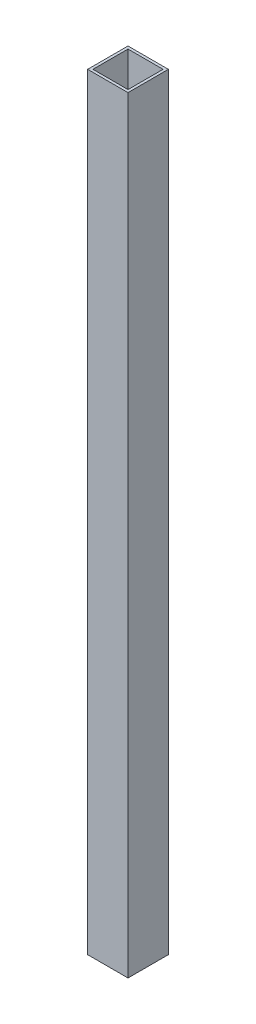
from build123d import *

# Parameters (mm, degrees)
SKETCH1_W           = 25.4
SKETCH1_H           = 25.4
BOSS_EXTRUDE1_DEPTH = 241.3
SKETCH2_W           = 22.098
SKETCH2_H           = 22.098
CUT_EXTRUDE1_DEPTH  = 483.934094883


with BuildPart() as part:
    # Sketch1 → Boss-Extrude1 (new, symmetric)
    with BuildSketch(Plane(origin=(0, 0, 0), x_dir=(1, 0, 0), z_dir=(0, 1, 0))):
        Rectangle(SKETCH1_W, SKETCH1_H)
    extrude(amount=BOSS_EXTRUDE1_DEPTH, both=True)

    # Sketch2 → Cut-Extrude1 (cut, through all)
    with BuildSketch(Plane(origin=(0, 241.3, 0), x_dir=(1, 0, 0), z_dir=(0, 1, 0))):
        Rectangle(SKETCH2_W, SKETCH2_H)
    extrude(amount=-CUT_EXTRUDE1_DEPTH, mode=Mode.SUBTRACT)


solid = part.part
